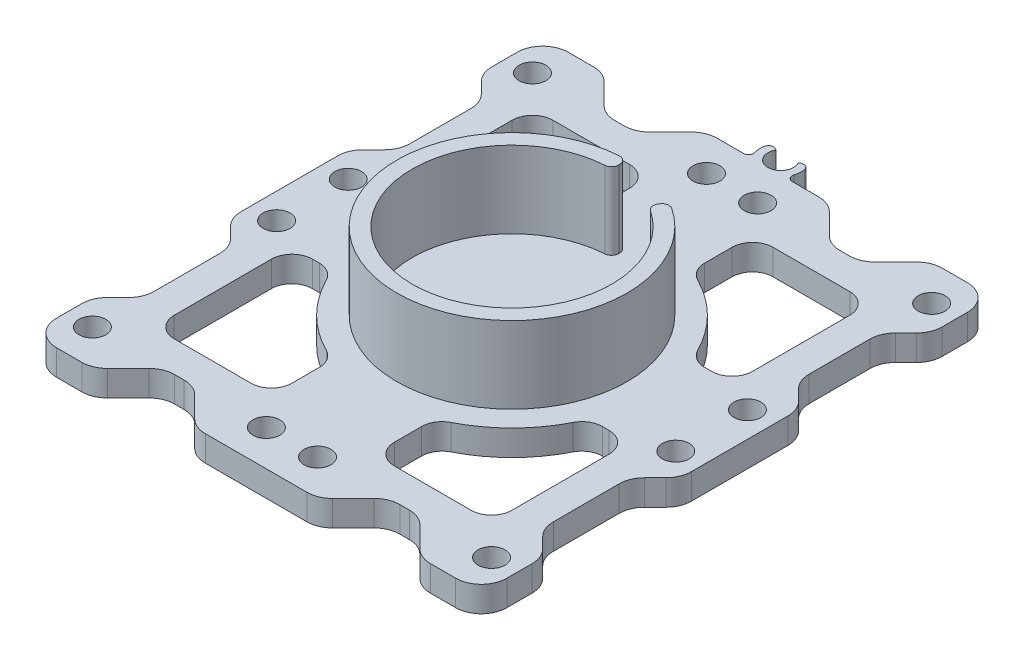
from build123d import *

# Parameters (mm, degrees)
SKETCH1_R           = 2.625
BOSS_EXTRUDE1_DEPTH = 5
BOSS_EXTRUDE2_DEPTH = 15
CUT_EXTRUDE1_DEPTH  = 72.28959702


with BuildPart() as part:
    # Sketch1 → Boss-Extrude1 (new body)
    with BuildSketch(Plane(origin=(0, 0, 0), x_dir=(1, 0, 0), z_dir=(0, 1, 0))):
        with BuildLine():
            Line((9.928932188, 50), (4.769696007, 50))
            ThreePointArc((4.769696007, 50), (3.963470232, 50.408392022), (3.815756806, 51.3))
            ThreePointArc((3.815756806, 51.3), (3.9926901, 52.258285774), (3.93265299, 53.230917545))
            ThreePointArc((3.93265299, 53.230917545), (3.367921389, 53.956436449), (2.449489743, 53.914213562))
            Line((2.449489743, 53.914213562), (2.165063509, 53.75))
            ThreePointArc((2.165063509, 53.75), (0, 50), (-2.165063509, 53.75))
            Line((-2.165063509, 53.75), (-2.449489743, 53.914213562))
            ThreePointArc((-2.449489743, 53.914213562), (-3.367921389, 53.956436449), (-3.93265299, 53.230917545))
            ThreePointArc((-3.93265299, 53.230917545), (-3.9926901, 52.258285774), (-3.815756806, 51.3))
            ThreePointArc((-3.815756806, 51.3), (-3.963470232, 50.408392022), (-4.769696007, 50))
            Line((-4.769696007, 50), (-9.928932188, 50))
            ThreePointArc((-9.928932188, 50), (-11.84234935, 49.619397663), (-13.464466094, 48.535533906))
            Line((-13.464466094, 48.535533906), (-17.535533906, 44.464466094))
            ThreePointArc((-17.535533906, 44.464466094), (-19.15765065, 43.380602337), (-21.071067812, 43))
            Line((-21.071067812, 43), (-22.928932188, 43))
            ThreePointArc((-22.928932188, 43), (-24.84234935, 43.380602337), (-26.464466094, 44.464466094))
            Line((-26.464466094, 44.464466094), (-30.535533906, 48.535533906))
            ThreePointArc((-30.535533906, 48.535533906), (-32.15765065, 49.619397663), (-34.071067812, 50))
            Line((-34.071067812, 50), (-39, 50))
            ThreePointArc((-39, 50), (-42.535533906, 48.535533906), (-44, 45))
            Line((-44, 45), (-44, 40.071067812))
            ThreePointArc((-44, 40.071067812), (-43.619397663, 38.15765065), (-42.535533906, 36.535533906))
            Line((-42.535533906, 36.535533906), (-40.464466094, 34.464466094))
            ThreePointArc((-40.464466094, 34.464466094), (-39.380602337, 32.84234935), (-39, 30.928932188))
            Line((-39, 30.928932188), (-39, 19.071067812))
            ThreePointArc((-39, 19.071067812), (-39.380602337, 17.15765065), (-40.464466094, 15.535533906))
            Line((-40.464466094, 15.535533906), (-42.535533906, 13.464466094))
            ThreePointArc((-42.535533906, 13.464466094), (-43.619397663, 11.84234935), (-44, 9.928932188))
            Line((-44, 9.928932188), (-44, -8.928932188))
            ThreePointArc((-44, -8.928932188), (-43.619397663, -10.84234935), (-42.535533906, -12.464466094))
            Line((-42.535533906, -12.464466094), (-40.464466094, -14.535533906))
            ThreePointArc((-40.464466094, -14.535533906), (-39.380602337, -16.15765065), (-39, -18.071067812))
            Line((-39, -18.071067812), (-39, -30.928932188))
            ThreePointArc((-39, -30.928932188), (-39.380602337, -32.84234935), (-40.464466094, -34.464466094))
            Line((-40.464466094, -34.464466094), (-42.535533906, -36.535533906))
            ThreePointArc((-42.535533906, -36.535533906), (-43.619397663, -38.15765065), (-44, -40.071067812))
            Line((-44, -40.071067812), (-44, -45))
            ThreePointArc((-44, -45), (-42.535533906, -48.535533906), (-39, -50))
            Line((-39, -50), (-34.071067812, -50))
            ThreePointArc((-34.071067812, -50), (-32.15765065, -49.619397663), (-30.535533906, -48.535533906))
            Line((-30.535533906, -48.535533906), (-26.464466094, -44.464466094))
            ThreePointArc((-26.464466094, -44.464466094), (-24.84234935, -43.380602337), (-22.928932188, -43))
            Line((-22.928932188, -43), (-21.071067812, -43))
            ThreePointArc((-21.071067812, -43), (-19.15765065, -43.380602337), (-17.535533906, -44.464466094))
            Line((-17.535533906, -44.464466094), (-13.464466094, -48.535533906))
            ThreePointArc((-13.464466094, -48.535533906), (-11.84234935, -49.619397663), (-9.928932188, -50))
            Line((-9.928932188, -50), (9.928932188, -50))
            ThreePointArc((9.928932188, -50), (11.84234935, -49.619397663), (13.464466094, -48.535533906))
            Line((13.464466094, -48.535533906), (17.535533906, -44.464466094))
            ThreePointArc((17.535533906, -44.464466094), (19.15765065, -43.380602337), (21.071067812, -43))
            Line((21.071067812, -43), (22.928932188, -43))
            ThreePointArc((22.928932188, -43), (24.84234935, -43.380602337), (26.464466094, -44.464466094))
            Line((26.464466094, -44.464466094), (30.535533906, -48.535533906))
            ThreePointArc((30.535533906, -48.535533906), (32.15765065, -49.619397663), (34.071067812, -50))
            Line((34.071067812, -50), (39, -50))
            ThreePointArc((39, -50), (42.535533906, -48.535533906), (44, -45))
            Line((44, -45), (44, -40.071067812))
            ThreePointArc((44, -40.071067812), (43.619397663, -38.15765065), (42.535533906, -36.535533906))
            Line((42.535533906, -36.535533906), (40.464466094, -34.464466094))
            ThreePointArc((40.464466094, -34.464466094), (39.380602337, -32.84234935), (39, -30.928932188))
            Line((39, -30.928932188), (39, -18.071067812))
            ThreePointArc((39, -18.071067812), (39.380602337, -16.15765065), (40.464466094, -14.535533906))
            Line((40.464466094, -14.535533906), (42.535533906, -12.464466094))
            ThreePointArc((42.535533906, -12.464466094), (43.619397663, -10.84234935), (44, -8.928932188))
            Line((44, -8.928932188), (44, 9.928932188))
            ThreePointArc((44, 9.928932188), (43.619397663, 11.84234935), (42.535533906, 13.464466094))
            Line((42.535533906, 13.464466094), (40.464466094, 15.535533906))
            ThreePointArc((40.464466094, 15.535533906), (39.380602337, 17.15765065), (39, 19.071067812))
            Line((39, 19.071067812), (39, 30.928932188))
            ThreePointArc((39, 30.928932188), (39.380602337, 32.84234935), (40.464466094, 34.464466094))
            Line((40.464466094, 34.464466094), (42.535533906, 36.535533906))
            ThreePointArc((42.535533906, 36.535533906), (43.619397663, 38.15765065), (44, 40.071067812))
            Line((44, 40.071067812), (44, 45))
            ThreePointArc((44, 45), (42.535533906, 48.535533906), (39, 50))
            Line((39, 50), (34.071067812, 50))
            ThreePointArc((34.071067812, 50), (32.15765065, 49.619397663), (30.535533906, 48.535533906))
            Line((30.535533906, 48.535533906), (26.464466094, 44.464466094))
            ThreePointArc((26.464466094, 44.464466094), (24.84234935, 43.380602337), (22.928932188, 43))
            Line((22.928932188, 43), (21.071067812, 43))
            ThreePointArc((21.071067812, 43), (19.15765065, 43.380602337), (17.535533906, 44.464466094))
            Line((17.535533906, 44.464466094), (13.464466094, 48.535533906))
            ThreePointArc((13.464466094, 48.535533906), (11.84234935, 49.619397663), (9.928932188, 50))
        make_face()
        with Locations(Location((-39, 43, 0), (0, 0, 270))):
            Circle(SKETCH1_R, mode=Mode.SUBTRACT)
        with Locations(Location((-5, 43, 0), (0, 0, 270))):
            Circle(SKETCH1_R, mode=Mode.SUBTRACT)
        with Locations(Location((-39, 7, 0), (0, 0, 270))):
            Circle(SKETCH1_R, mode=Mode.SUBTRACT)
        with Locations(Location((-39, -43, 0), (0, 0, 270))):
            Circle(SKETCH1_R, mode=Mode.SUBTRACT)
        with Locations(Location((-5, -43, 0), (0, 0, 270))):
            Circle(SKETCH1_R, mode=Mode.SUBTRACT)
        with Locations(Location((-39, -7, 0), (0, 0, 270))):
            Circle(SKETCH1_R, mode=Mode.SUBTRACT)
        with Locations(Location((39, -7, 0), (0, 0, 90))):
            Circle(SKETCH1_R, mode=Mode.SUBTRACT)
        with Locations(Location((5, -43, 0), (0, 0, 90))):
            Circle(SKETCH1_R, mode=Mode.SUBTRACT)
        with Locations(Location((39, -43, 0), (0, 0, 90))):
            Circle(SKETCH1_R, mode=Mode.SUBTRACT)
        with Locations(Location((39, 7, 0), (0, 0, 90))):
            Circle(SKETCH1_R, mode=Mode.SUBTRACT)
        with Locations(Location((5, 43, 0), (0, 0, 90))):
            Circle(SKETCH1_R, mode=Mode.SUBTRACT)
        with Locations(Location((39, 43, 0), (0, 0, 90))):
            Circle(SKETCH1_R, mode=Mode.SUBTRACT)
    extrude(amount=BOSS_EXTRUDE1_DEPTH)

    # Sketch2 → Boss-Extrude2 (add)
    with BuildSketch(Plane(origin=(0, 5, 0), x_dir=(1, 0, 0), z_dir=(0, 1, 0))):
        with BuildLine():
            Line((0, 20.85305733), (0, 21.053503271))
            ThreePointArc((0, 21.053503271), (-0.443456063, 22.075767277), (-1.492890995, 22.45041818))
            ThreePointArc((-1.492890995, 22.45041818), (-5.823428515, -21.733331092), (12.518090617, 18.696186972))
            ThreePointArc((12.518090617, 18.696186972), (11.421927854, 18.896447238), (10.526751636, 18.232868672))
            Line((10.526751636, 18.232868672), (10.426528665, 18.059277394))
            ThreePointArc((10.426528665, 18.059277394), (10.275284789, 17.042451921), (10.859320693, 16.196454985))
            ThreePointArc((10.859320693, 16.196454985), (-5.046971379, -18.835553613), (-1.306220096, 19.456201815))
            ThreePointArc((-1.306220096, 19.456201815), (-0.377431698, 19.896838701), (0, 20.85305733))
        make_face()
    extrude(amount=BOSS_EXTRUDE2_DEPTH)

    # Sketch3 → Cut-Extrude1 (cut, through all)
    with BuildSketch(Plane(origin=(0, 5, 0), x_dir=(1, 0, 0), z_dir=(0, 1, 0))):
        with BuildLine():
            Line((-29, 37), (-14, 37))
            ThreePointArc((-14, 37), (-11.171572875, 35.828427125), (-10, 33))
            Line((-10, 33), (-10, 27.658633372))
            ThreePointArc((-10, 27.658633372), (-10.592228995, 25.56409362), (-12.193548387, 24.089777453))
            ThreePointArc((-12.193548387, 24.089777453), (-19.091883092, 19.091883092), (-24.089777453, 12.193548387))
            ThreePointArc((-24.089777453, 12.193548387), (-25.56409362, 10.592228995), (-27.658633372, 10))
            Line((-27.658633372, 10), (-29, 10))
            ThreePointArc((-29, 10), (-31.828427125, 11.171572875), (-33, 14))
            Line((-33, 14), (-33, 33))
            ThreePointArc((-33, 33), (-31.828427125, 35.828427125), (-29, 37))
        make_face()
        with BuildLine():
            Line((33, 33), (33, 14))
            ThreePointArc((33, 14), (31.828427125, 11.171572875), (29, 10))
            Line((29, 10), (27.658633372, 10))
            ThreePointArc((27.658633372, 10), (25.56409362, 10.592228995), (24.089777453, 12.193548387))
            ThreePointArc((24.089777453, 12.193548387), (19.091883092, 19.091883092), (12.193548387, 24.089777453))
            ThreePointArc((12.193548387, 24.089777453), (10.592228995, 25.56409362), (10, 27.658633372))
            Line((10, 27.658633372), (10, 33))
            ThreePointArc((10, 33), (11.171572875, 35.828427125), (14, 37))
            Line((14, 37), (29, 37))
            ThreePointArc((29, 37), (31.828427125, 35.828427125), (33, 33))
        make_face()
        with BuildLine():
            Line((29, -37), (14, -37))
            ThreePointArc((14, -37), (11.171572875, -35.828427125), (10, -33))
            Line((10, -33), (10, -27.658633372))
            ThreePointArc((10, -27.658633372), (10.592228995, -25.56409362), (12.193548387, -24.089777453))
            ThreePointArc((12.193548387, -24.089777453), (19.091883092, -19.091883092), (24.089777453, -12.193548387))
            ThreePointArc((24.089777453, -12.193548387), (25.56409362, -10.592228995), (27.658633372, -10))
            Line((27.658633372, -10), (29, -10))
            ThreePointArc((29, -10), (31.828427125, -11.171572875), (33, -14))
            Line((33, -14), (33, -33))
            ThreePointArc((33, -33), (31.828427125, -35.828427125), (29, -37))
        make_face()
        with BuildLine():
            Line((-33, -33), (-33, -14))
            ThreePointArc((-33, -14), (-31.828427125, -11.171572875), (-29, -10))
            Line((-29, -10), (-27.658633372, -10))
            ThreePointArc((-27.658633372, -10), (-25.56409362, -10.592228995), (-24.089777453, -12.193548387))
            ThreePointArc((-24.089777453, -12.193548387), (-19.091883092, -19.091883092), (-12.193548387, -24.089777453))
            ThreePointArc((-12.193548387, -24.089777453), (-10.592228995, -25.56409362), (-10, -27.658633372))
            Line((-10, -27.658633372), (-10, -33))
            ThreePointArc((-10, -33), (-11.171572875, -35.828427125), (-14, -37))
            Line((-14, -37), (-29, -37))
            ThreePointArc((-29, -37), (-31.828427125, -35.828427125), (-33, -33))
        make_face()
    extrude(amount=-CUT_EXTRUDE1_DEPTH, mode=Mode.SUBTRACT)


solid = part.part
